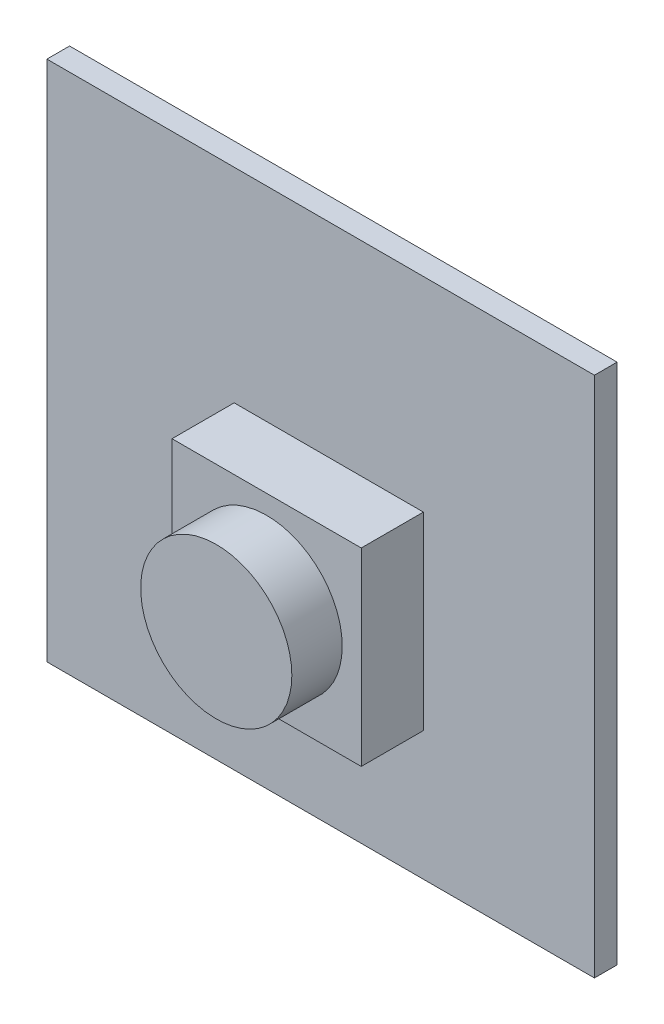
from build123d import *

# Parameters (mm, degrees)
SKETCH1_W           = 24.8412
SKETCH1_H           = 23.6855
BOSS_EXTRUDE1_DEPTH = 1.0287
SKETCH2_W           = 8.5852
SKETCH2_H           = 8.5852
BOSS_EXTRUDE2_DEPTH = 2.8194
SKETCH3_R           = 3.429
BOSS_EXTRUDE3_DEPTH = 2.286


with BuildPart() as part:
    # Sketch1 → Boss-Extrude1 (new body)
    with BuildSketch(Plane.XY):
        Rectangle(SKETCH1_W, SKETCH1_H)
    extrude(amount=BOSS_EXTRUDE1_DEPTH)

    # Sketch2 → Boss-Extrude2 (add)
    with BuildSketch(Plane.XY.offset(1.0287)):
        with Locations((0.3683, -1.70815)):
            Rectangle(SKETCH2_W, SKETCH2_H)
    extrude(amount=BOSS_EXTRUDE2_DEPTH)

    # Sketch3 → Boss-Extrude3 (add)
    with BuildSketch(Plane.XY.offset(3.8481)):
        with Locations((0.3683, -1.70815)):
            Circle(SKETCH3_R)
    extrude(amount=BOSS_EXTRUDE3_DEPTH)


solid = part.part
